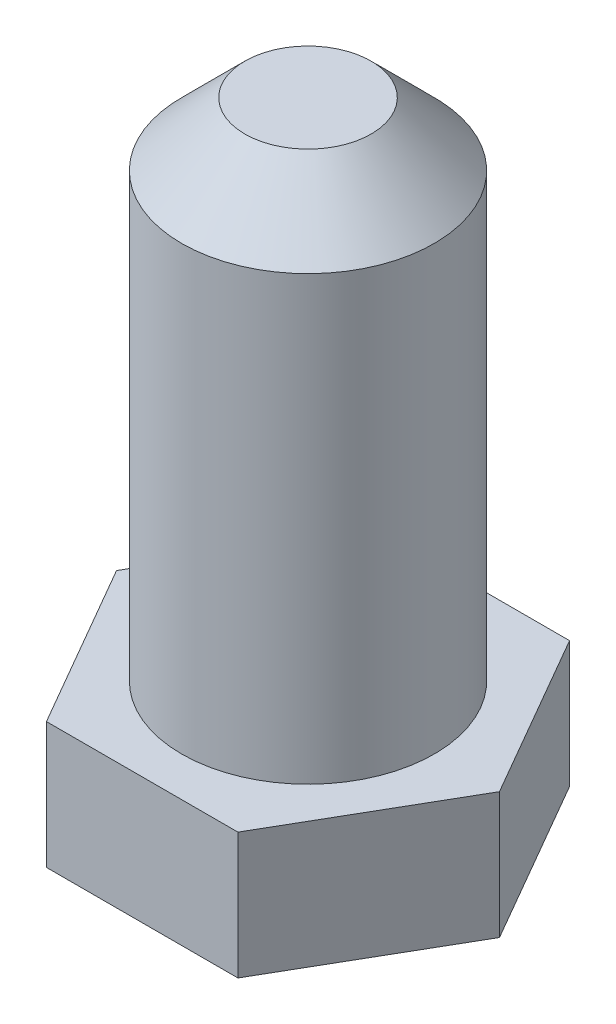
from build123d import *

# Parameters (mm, degrees)
BOSS_EXTRUDE1_DEPTH = 12.7
SKETCH2_R           = 12.7
BOSS_EXTRUDE2_DEPTH = 44.45
SKETCH3_R           = 12.7
BOSS_EXTRUDE3_DEPTH = 6.35
CHAMFER1_SIZE       = 6.35


with BuildPart() as part:
    # Sketch1 → Boss-Extrude1 (new body)
    with BuildSketch(Plane(origin=(0, 0, 0), x_dir=(1, 0, 0), z_dir=(0, 1, 0))):
        Polygon((19.247414599, 0), (9.6237073, 16.66875), (-9.6237073, 16.66875), (-19.247414599, 0), (-9.6237073, -16.66875), (9.6237073, -16.66875), align=None)
    extrude(amount=BOSS_EXTRUDE1_DEPTH)

    # Sketch2 → Boss-Extrude2 (add)
    with BuildSketch(Plane(origin=(0, 12.7, 0), x_dir=(1, 0, 0), z_dir=(0, 1, 0))):
        with Locations(Location((0, 0, 0), (0, 0, 270))):
            Circle(SKETCH2_R)
    extrude(amount=BOSS_EXTRUDE2_DEPTH)

    # Sketch3 → Boss-Extrude3 (add)
    with BuildSketch(Plane(origin=(0, 57.15, 0), x_dir=(1, 0, 0), z_dir=(0, 1, 0))):
        with Locations(Location((0, 0, 0), (0, 0, 270))):
            Circle(SKETCH3_R)
    extrude(amount=BOSS_EXTRUDE3_DEPTH)

    # Chamfer1
    chamfer1_edges = [part.edges().sort_by_distance(p)[0] for p in [
        (0, 63.5, -12.7),
    ]]
    chamfer(chamfer1_edges, length=CHAMFER1_SIZE)


solid = part.part
